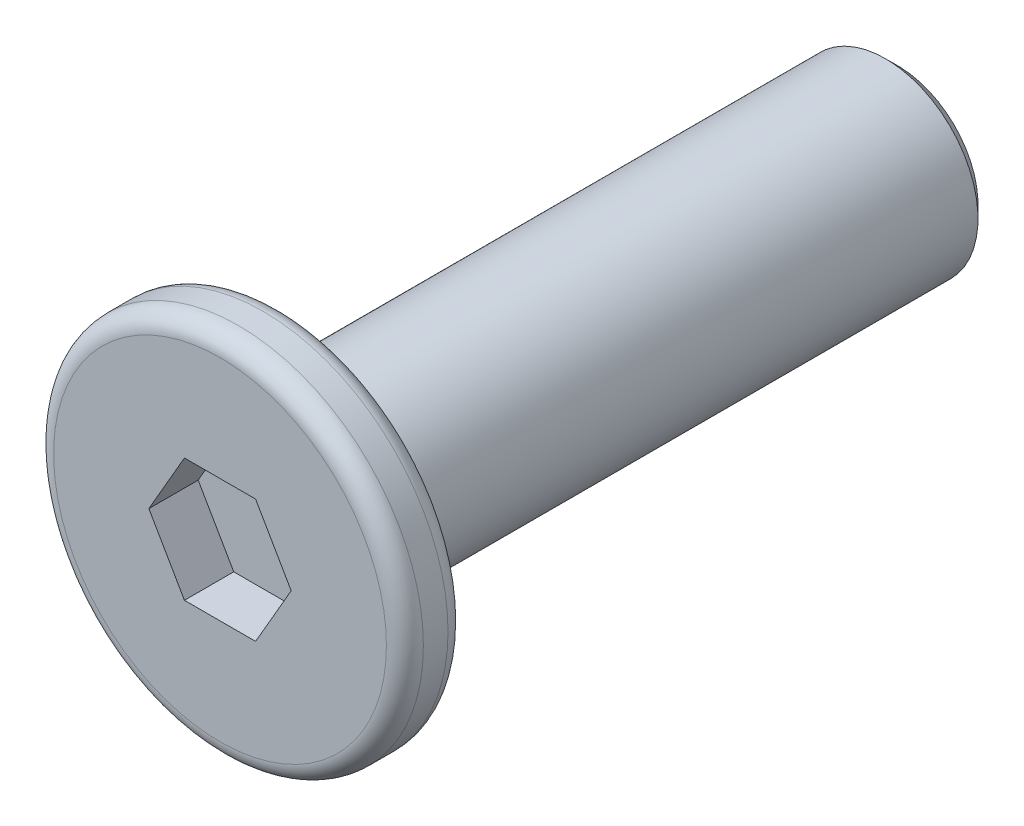
from build123d import *

# Parameters (mm, degrees)
SKETCH_1_R          = 3
EXTRUDE_1_DEPTH     = 0.5
SKETCH_2_R          = 1.5
EXTRUDE_2_DEPTH     = 10
CHAMFER_1_SIZE      = 0.2
CUT_EXTRUDE_1_DEPTH = 0.8
FILLET_2_R          = 0.3


with BuildPart() as part:
    # 草图1 → 凸台-拉伸1 (new, symmetric)
    with BuildSketch(Plane.XY):
        Circle(SKETCH_1_R)
    extrude(amount=EXTRUDE_1_DEPTH, both=True)

    # 草图2 → 凸台-拉伸2 (add)
    with BuildSketch(Plane(origin=(0, 0, -0.5), x_dir=(-1, 0, 0), z_dir=(0, 0, -1))):
        Circle(SKETCH_2_R)
    extrude(amount=EXTRUDE_2_DEPTH)

    # 倒角1
    chamfer_1_edges = [part.edges().sort_by_distance(p)[0] for p in [
        (1.5, 0, -10.5),
    ]]
    chamfer(chamfer_1_edges, length=CHAMFER_1_SIZE)

    # 草图3 → 切除-拉伸1 (cut)
    with BuildSketch(Plane.XY.offset(0.5)):
        Polygon((1.154700538, 0), (0.577350269, 1), (-0.577350269, 1), (-1.154700538, 0), (-0.577350269, -1), (0.577350269, -1), align=None)
    extrude(amount=-CUT_EXTRUDE_1_DEPTH, mode=Mode.SUBTRACT)

    # 圆角2
    fillet_2_edges = [part.edges().sort_by_distance(p)[0] for p in [
        (-3, 0, -0.5),
        (-3, 0, 0.5),
    ]]
    fillet(fillet_2_edges, radius=FILLET_2_R)


solid = part.part
